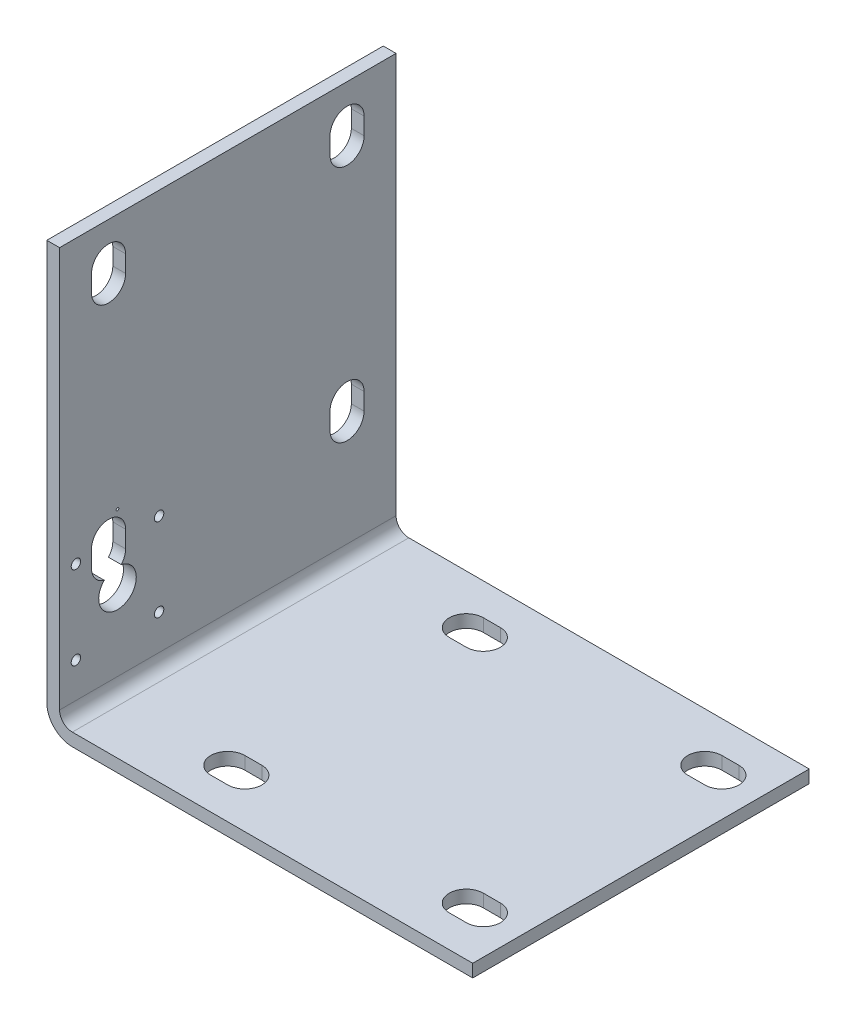
from build123d import *

# Parameters (mm, degrees)
BOSS_EXTRUDE1_DEPTH = 62.70625
CUT_EXTRUDE1_DEPTH  = 224.410663511
SKETCH3_R           = 7
SKETCH3_R_2         = 1.75
SKETCH3_R_3         = 0.5
CUT_EXTRUDE2_DEPTH  = 224.410663511


with BuildPart() as part:
    # Sketch1 → Boss-Extrude1 (new, symmetric)
    with BuildSketch(Plane.XY):
        with BuildLine():
            Line((-9.525, 149.225), (-4.7625, 149.225))
            Line((-4.7625, 149.225), (-4.7625, 0))
            ThreePointArc((-4.7625, 0), (-3.367596045, -3.367596045), (0, -4.7625))
            Line((0, -4.7625), (149.225, -4.7625))
            Line((149.225, -4.7625), (149.225, -9.525))
            Line((149.225, -9.525), (0, -9.525))
            ThreePointArc((0, -9.525), (-6.735192091, -6.735192091), (-9.525, 0))
            Line((-9.525, 0), (-9.525, 149.225))
        make_face()
    extrude(amount=BOSS_EXTRUDE1_DEPTH, both=True)

    # Sketch2 → Cut-Extrude1 (cut, through all)
    with BuildSketch(Plane(origin=(-4.7625, 0, 0), x_dir=(0, 0, -1), z_dir=(1, 0, 0))):
        with BuildLine():
            Line((-50.8, 134.9375), (-50.8, 128.5875))
            ThreePointArc((-50.8, 128.5875), (-44.45, 122.2375), (-38.1, 128.5875))
            Line((-38.1, 128.5875), (-38.1, 134.9375))
            ThreePointArc((-38.1, 134.9375), (-44.45, 141.2875), (-50.8, 134.9375))
        make_face()
        with BuildLine():
            Line((-50.8, 46.0375), (-50.8, 39.6875))
            ThreePointArc((-50.8, 39.6875), (-44.45, 33.3375), (-38.1, 39.6875))
            Line((-38.1, 39.6875), (-38.1, 46.0375))
            ThreePointArc((-38.1, 46.0375), (-44.45, 52.3875), (-50.8, 46.0375))
        make_face()
        with BuildLine():
            Line((38.1, 39.6875), (38.1, 46.0375))
            ThreePointArc((38.1, 46.0375), (44.45, 52.3875), (50.8, 46.0375))
            Line((50.8, 46.0375), (50.8, 39.6875))
            ThreePointArc((50.8, 39.6875), (44.45, 33.3375), (38.1, 39.6875))
        make_face()
        with BuildLine():
            Line((38.1, 134.9375), (38.1, 128.5875))
            ThreePointArc((38.1, 128.5875), (44.45, 122.2375), (50.8, 128.5875))
            Line((50.8, 128.5875), (50.8, 134.9375))
            ThreePointArc((50.8, 134.9375), (44.45, 141.2875), (38.1, 134.9375))
        make_face()
    cut_extrude1 = extrude(amount=-CUT_EXTRUDE1_DEPTH, mode=Mode.SUBTRACT)

    # Mirror1: Cut-Extrude1 across plane
    add(cut_extrude1.mirror(Plane(origin=(0, 0, 0), x_dir=(0, 0, 1), z_dir=(0.7071067811865475, -0.7071067811865476, 0))), mode=Mode.SUBTRACT)

    # Sketch3 → Cut-Extrude2 (cut, through all)
    with BuildSketch(Plane(origin=(-4.7625, 0, 0), x_dir=(0, 0, -1), z_dir=(1, 0, 0))):
        with Locations((-41.11625, 28.575)):
            Circle(SKETCH3_R)
        with Locations((-25.61625, 44.075)):
            Circle(SKETCH3_R_2)
        with Locations((-56.61625, 44.075)):
            Circle(SKETCH3_R_2)
        with Locations((-25.61625, 13.075)):
            Circle(SKETCH3_R_2)
        with Locations((-56.61625, 13.075)):
            Circle(SKETCH3_R_2)
        with Locations((-41.11625, 53.975)):
            Circle(SKETCH3_R_3)
    extrude(amount=-CUT_EXTRUDE2_DEPTH, mode=Mode.SUBTRACT)


solid = part.part
